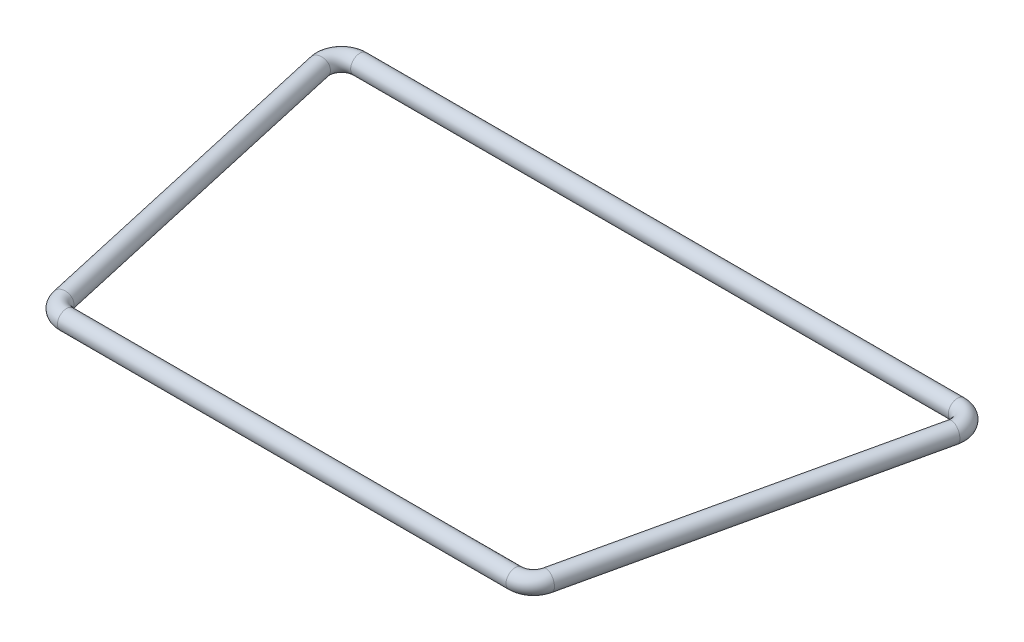
from build123d import *

# Parameters (mm, degrees)
SWEEP1_PROFILE_R = 1.27


with BuildPart() as part:
    # Sweep1: sweep along a path in Sketch1
    with BuildLine(Plane(origin=(0, 0, 0), x_dir=(1, 0, 0), z_dir=(0, 1, 0))) as sweep1_path:
        Line((-41.275, 50.8), (41.275, 50.8))
        ThreePointArc((41.275, 50.8), (43.258406776, 49.846725421), (43.75304878, 47.702439024))
        Line((43.75304878, 47.702439024), (33.46604878, 1.982439024))
        ThreePointArc((33.46604878, 1.982439024), (32.574725421, 0.556593224), (30.988, 0))
        Line((30.988, 0), (-30.988, 0))
        ThreePointArc((-30.988, 0), (-32.574725421, 0.556593224), (-33.46604878, 1.982439024))
        Line((-33.46604878, 1.982439024), (-43.75304878, 47.702439024))
        ThreePointArc((-43.75304878, 47.702439024), (-43.258406776, 49.846725421), (-41.275, 50.8))
    # Sweep1 profile (on start of the path) → Sweep1 (sweep)
    with BuildSketch(Plane(origin=(-41.275, 0, -50.8), x_dir=(0, 0, 1), z_dir=(1, 0, 0))):
        Circle(SWEEP1_PROFILE_R)
    sweep(path=sweep1_path.line)


solid = part.part
